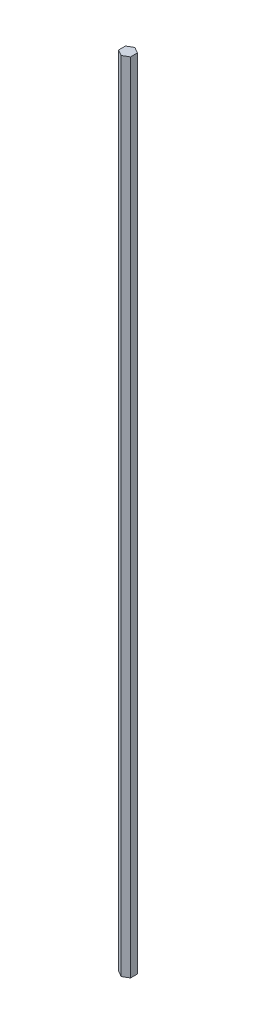
from build123d import *

# Parameters (mm, degrees)
BOSS_EXTRUDE1_DEPTH = 1000


with BuildPart() as part:
    # Sketch1 → Boss-Extrude1 (new body)
    with BuildSketch(Plane(origin=(0, 0, 0), x_dir=(1, 0, 0), z_dir=(0, 1, 0))):
        Polygon((0, 8.660254038), (-7.5, 4.330127019), (-7.5, -4.330127019), (0, -8.660254038), (7.5, -4.330127019), (7.5, 4.330127019), align=None)
    extrude(amount=BOSS_EXTRUDE1_DEPTH)


solid = part.part
